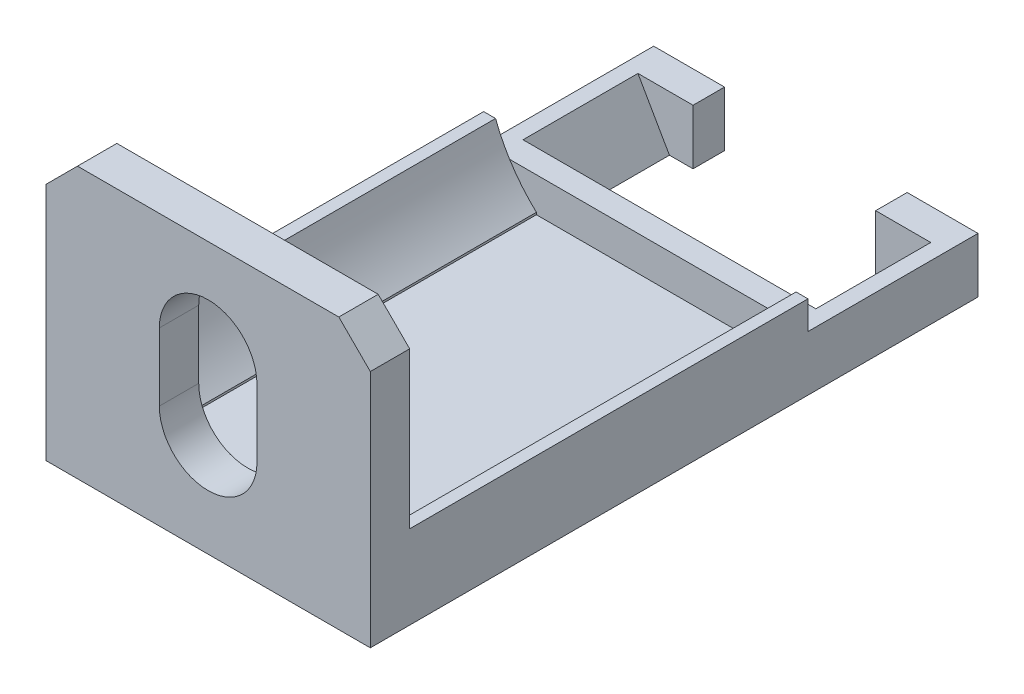
from build123d import *

# Parameters (mm, degrees)
SKETCH1_W           = 20.6
SKETCH1_H           = 17.2
BOSS_EXTRUDE1_DEPTH = 2.5
SKETCH2_W           = 20.6
SKETCH2_H           = 1.3
BOSS_EXTRUDE2_DEPTH = 25.3
SKETCH3_W           = 20.6
SKETCH3_H           = 3.5
BOSS_EXTRUDE3_DEPTH = 1.5
SKETCH4_W           = 3.35
SKETCH4_H           = 25.3
BOSS_EXTRUDE4_DEPTH = 4
CUT_EXTRUDE2_START  = 25.3
CUT_EXTRUDE2_DEPTH  = 25.3
CHAMFER1_SIZE       = 2
BOSS_EXTRUDE5_DEPTH = 9.3
SKETCH7_W           = 4.5
SKETCH7_H           = 3.5
BOSS_EXTRUDE6_DEPTH = 2


with BuildPart() as part:
    # Sketch1 → Boss-Extrude1 (new body)
    with BuildSketch(Plane.XY):
        Rectangle(SKETCH1_W, SKETCH1_H)
        with BuildLine():
            Line((3.1, 2.3), (3.1, -2))
            ThreePointArc((3.1, -2), (0, -5.1), (-3.1, -2))
            Line((-3.1, -2), (-3.1, 2.3))
            ThreePointArc((-3.1, 2.3), (0, 5.4), (3.1, 2.3))
        make_face(mode=Mode.SUBTRACT)
    extrude(amount=BOSS_EXTRUDE1_DEPTH)

    # Sketch2 → Boss-Extrude2 (add)
    with BuildSketch(Plane(origin=(0, 0, 0), x_dir=(-1, 0, 0), z_dir=(0, 0, -1))):
        with Locations((0, -7.95)):
            Rectangle(SKETCH2_W, SKETCH2_H)
    extrude(amount=BOSS_EXTRUDE2_DEPTH)

    # Sketch3 → Boss-Extrude3 (add)
    with BuildSketch(Plane(origin=(0, 0, -25.3), x_dir=(-1, 0, 0), z_dir=(0, 0, -1))):
        with Locations((0, -6.85)):
            Rectangle(SKETCH3_W, SKETCH3_H)
    extrude(amount=BOSS_EXTRUDE3_DEPTH)

    # Sketch4 → Boss-Extrude4 (add)
    with BuildSketch(Plane(origin=(0, -7.3, 0), x_dir=(1, 0, 0), z_dir=(0, 1, 0))):
        with Locations((-8.625, 12.65)):
            Rectangle(SKETCH4_W, SKETCH4_H)
        with Locations((8.625, 12.65)):
            Rectangle(SKETCH4_W, SKETCH4_H)
    extrude(amount=BOSS_EXTRUDE4_DEPTH)

    # Sketch5 → Cut-Extrude2 (cut)
    # profile 1 of 3: a face of its own
    with BuildSketch(Plane(origin=(0, 0, 0), x_dir=(-1, 0, 0), z_dir=(0, 0, -1)).offset(CUT_EXTRUDE2_START)):
        with BuildLine():
            Line((-6.802940541, -7.3), (6.802940541, -7.3))
            ThreePointArc((6.802940541, -7.3), (6.876797859, -7.233236436), (6.95, -7.165755153))
            Line((6.95, -7.165755153), (6.95, -3.3))
            Line((6.95, -3.3), (9.543584232, -3.3))
            ThreePointArc((9.543584232, -3.3), (10.034554279, -1.529677681), (10.2, 0.3))
            ThreePointArc((10.2, 0.3), (9.069541999, 4.967269858), (5.928743543, 8.6))
            Line((5.928743543, 8.6), (-5.928743543, 8.6))
            ThreePointArc((-5.928743543, 8.6), (-9.759648134, 3.264670016), (-9.543584232, -3.3))
            Line((-9.543584232, -3.3), (-6.95, -3.3))
            Line((-6.95, -3.3), (-6.95, -7.165755153))
            ThreePointArc((-6.95, -7.165755153), (-6.876797859, -7.233236436), (-6.802940541, -7.3))
        make_face()
        with BuildLine():
            ThreePointArc((3.1, -2), (0, -5.1), (-3.1, -2))
            Line((-3.1, -2), (-3.1, 2.3))
            ThreePointArc((-3.1, 2.3), (0, 5.4), (3.1, 2.3))
            Line((3.1, 2.3), (3.1, -2))
        make_face(mode=Mode.SUBTRACT)
    # profile 2 of 3: a face of its own
    with BuildSketch(Plane(origin=(0, 0, 0), x_dir=(-1, 0, 0), z_dir=(0, 0, -1)).offset(CUT_EXTRUDE2_START)):
        with BuildLine():
            Line((6.95, -3.3), (6.95, -7.165755153))
            ThreePointArc((6.95, -7.165755153), (8.470277205, -5.382816561), (9.543584232, -3.3))
            Line((9.543584232, -3.3), (6.95, -3.3))
        make_face()
    # profile 3 of 3: a face of its own
    with BuildSketch(Plane(origin=(0, 0, 0), x_dir=(-1, 0, 0), z_dir=(0, 0, -1)).offset(CUT_EXTRUDE2_START)):
        with BuildLine():
            ThreePointArc((-9.543584232, -3.3), (-8.470277205, -5.382816561), (-6.95, -7.165755153))
            Line((-6.95, -7.165755153), (-6.95, -3.3))
            Line((-6.95, -3.3), (-9.543584232, -3.3))
        make_face()
    extrude(amount=-CUT_EXTRUDE2_DEPTH, mode=Mode.SUBTRACT)

    # Chamfer1
    chamfer1_edges = [part.edges().sort_by_distance(p)[0] for p in [
        (-10.3, 8.6, 1.25),
        (10.3, 8.6, 1.25),
    ]]
    chamfer(chamfer1_edges, length=CHAMFER1_SIZE)

    # Sketch6 → Boss-Extrude5 (add)
    with BuildSketch(Plane(origin=(0, 0, -26.8), x_dir=(-1, 0, 0), z_dir=(0, 0, -1))):
        Polygon((-7.3, -8.6), (-10.3, -8.6), (-10.3, -5.1), (-9.3, -5.1), align=None)
        Polygon((9.3, -5.1), (7.3, -8.6), (10.3, -8.6), (10.3, -5.1), align=None)
    extrude(amount=BOSS_EXTRUDE5_DEPTH)

    # Sketch7 → Boss-Extrude6 (add)
    with BuildSketch(Plane(origin=(0, 0, -36.1), x_dir=(-1, 0, 0), z_dir=(0, 0, -1))):
        with Locations((-8.05, -6.85)):
            Rectangle(SKETCH7_W, SKETCH7_H)
        with Locations((8.05, -6.85)):
            Rectangle(SKETCH7_W, SKETCH7_H)
    extrude(amount=-BOSS_EXTRUDE6_DEPTH)


solid = part.part
